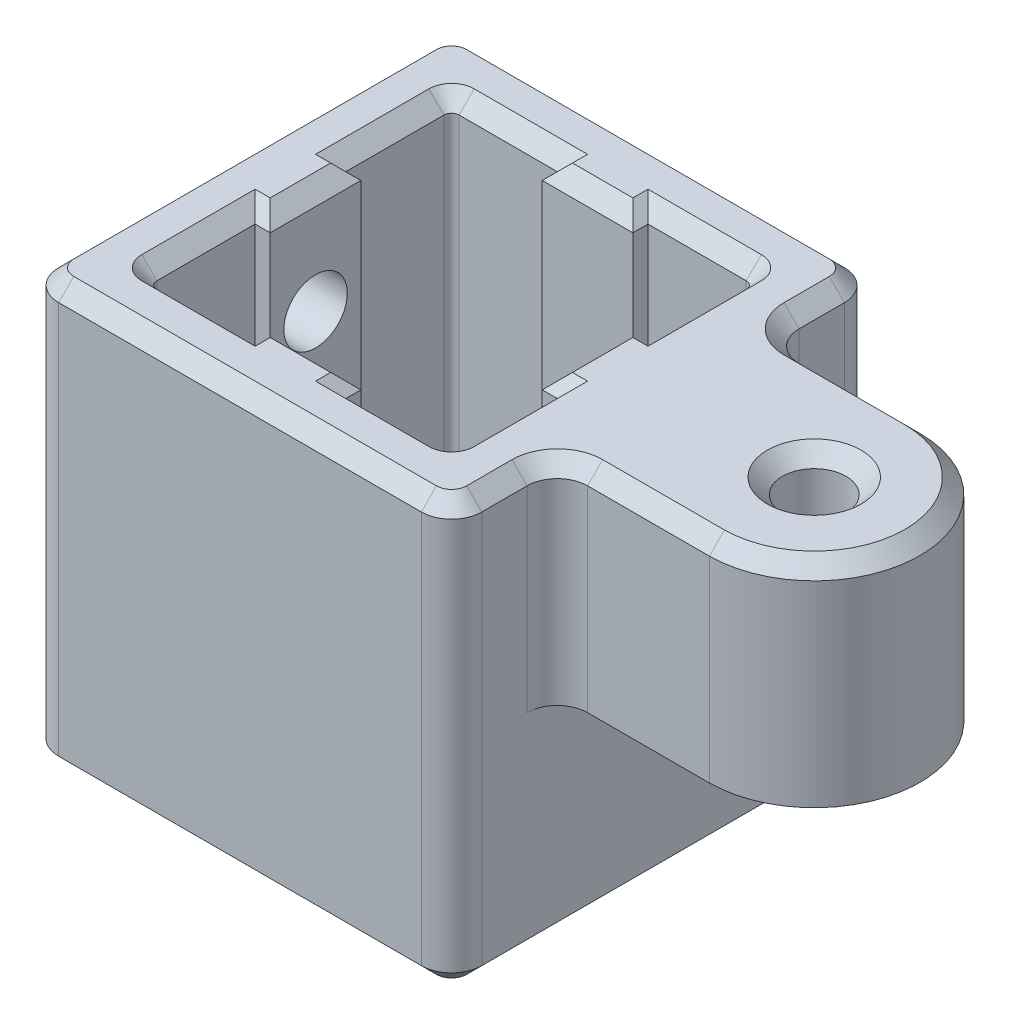
from build123d import *

# Parameters (mm, degrees)
CROQUIS1_R              = 2.1
SALIENTE_EXTRUIR1_DEPTH = 7
CROQUIS2_W              = 28
CROQUIS2_H              = 28
CROQUIS2_W_2            = 20
CROQUIS2_H_2            = 20
SALIENTE_EXTRUIR2_DEPTH = 28
CROQUIS3_W              = 6
CROQUIS3_H              = 1
CROQUIS3_W_2            = 1
CROQUIS3_H_2            = 6
SALIENTE_EXTRUIR3_DEPTH = 28
REDONDEO1_R             = 0.5
REDONDEO2_R             = 2
REDONDEO3_R             = 2
CHAFL_N1_SIZE           = 1
CHAFL_N3_SIZE           = 1
CORTAR_EXTRUIR2_REACH   = 53.595
CROQUIS4_R              = 2.1


with BuildPart() as part:
    # Croquis1 → Saliente-Extruir1 (new, symmetric)
    with BuildSketch(Plane(origin=(0, 0, 0), x_dir=(1, 0, 0), z_dir=(0, 1, 0))):
        with BuildLine():
            Line((0, 7), (-10, 7))
            Line((-10, 7), (-10, -6.999720999))
            Line((-10, -6.999720999), (0.062497509, -6.999720999))
            ThreePointArc((0.062497509, -6.999720999), (6.999930249, 0.031249066), (0, 7))
        make_face()
        with Locations(Location((0, 0, 0), (0, 0, 270))):
            Circle(CROQUIS1_R, mode=Mode.SUBTRACT)
    extrude(amount=SALIENTE_EXTRUIR1_DEPTH, both=True)

    # Croquis2 → Saliente-Extruir2 (add)
    with BuildSketch(Plane(origin=(0, 7, 0), x_dir=(1, 0, 0), z_dir=(0, 1, 0))):
        with Locations((-24, 0)):
            Rectangle(CROQUIS2_W, CROQUIS2_H)
        with Locations((-24, 0)):
            Rectangle(CROQUIS2_W_2, CROQUIS2_H_2, mode=Mode.SUBTRACT)
    extrude(amount=-SALIENTE_EXTRUIR2_DEPTH)

    # Croquis3 → Saliente-Extruir3 (add, through all)
    with BuildSketch(Plane(origin=(0, 7, 0), x_dir=(1, 0, 0), z_dir=(0, 1, 0))):
        with Locations((-24, 9.5)):
            Rectangle(CROQUIS3_W, CROQUIS3_H)
        with Locations((-14.5, 0)):
            Rectangle(CROQUIS3_W_2, CROQUIS3_H_2)
        with Locations((-24, -9.5)):
            Rectangle(CROQUIS3_W, CROQUIS3_H)
        with Locations((-33.5, 0)):
            Rectangle(CROQUIS3_W_2, CROQUIS3_H_2)
    extrude(amount=-SALIENTE_EXTRUIR3_DEPTH)

    # Redondeo1
    redondeo1_edges = [part.edges().sort_by_distance(p)[0] for p in [
        (-14, -7, 10),
        (-34, -7, 10),
        (-34, -7, -10),
        (-14, -7, -10),
    ]]
    fillet(redondeo1_edges, radius=REDONDEO1_R)

    # Redondeo2
    redondeo2_edges = [part.edges().sort_by_distance(p)[0] for p in [
        (-10, -7, -14),
        (-10, -7, 14),
        (-38, -7, 14),
        (-38, -7, -14),
    ]]
    fillet(redondeo2_edges, radius=REDONDEO2_R)

    # Redondeo3
    redondeo3_edges = [part.edges().sort_by_distance(p)[0] for p in [
        (-10, 0, 6.999720999),
        (-10, 0, -7),
    ]]
    fillet(redondeo3_edges, radius=REDONDEO3_R)

    # Chaflán1
    chafl_n1_edges = [part.edges().sort_by_distance(p)[0] for p in [
        (-30.25, -21, 10),
        (-14.146446609, -21, 9.853553391),
        (-14.146446609, -21, -9.853553391),
        (-33.853553391, -21, -9.853553391),
        (-33.853553391, -21, 9.853553391),
        (-24, -21, -14),
        (-38, -21, 0),
        (-10, -21, 0),
        (-24, -21, 14),
        (-10.585786438, -21, 13.414213562),
        (-37.414213562, -21, 13.414213562),
        (-10.585786438, -21, -13.414213562),
        (-37.414213562, -21, -13.414213562),
        (-30.25, -21, -10),
        (-21, -21, -9.5),
        (-24, -21, -9),
        (-27, -21, -9.5),
        (-14, -21, -6.25),
        (-14.5, -21, 3),
        (-15, -21, 0),
        (-14.5, -21, -3),
        (-17.75, -21, 10),
        (-27, -21, 9.5),
        (-24, -21, 9),
        (-21, -21, 9.5),
        (-34, -21, 6.25),
        (-33, -21, 0),
        (-33.5, -21, 3),
        (-33.5, -21, -3),
        (-14, -21, 6.25),
        (-17.75, -21, -10),
        (-34, -21, -6.25),
    ]]
    chamfer(chafl_n1_edges, length=CHAFL_N1_SIZE)

    # Chaflán3
    chafl_n3_edges = [part.edges().sort_by_distance(p)[0] for p in [
        (-21, 7, -9.5),
        (-24, 7, -9),
        (-27, 7, -9.5),
        (-30.25, 7, -10),
        (-33.853553391, 7, -9.853553391),
        (-34, 7, -6.25),
        (-33.5, 7, -3),
        (-33, 7, 0),
        (-33.5, 7, 3),
        (-34, 7, 6.25),
        (-33.853553391, 7, 9.853553391),
        (-30.25, 7, 10),
        (-27, 7, 9.5),
        (-24, 7, 9),
        (-21, 7, 9.5),
        (-17.75, 7, 10),
        (-14.146446609, 7, 9.853553391),
        (-14, 7, 6.25),
        (-14.5, 7, 3),
        (-15, 7, 0),
        (-14.5, 7, -3),
        (-14, 7, -6.25),
        (-14.146446609, 7, -9.853553391),
        (-17.75, 7, -10),
        (0, 7, -2.1),
        (-10.585786438, 7, -13.414213562),
        (-10, 7, -10.5),
        (-9.414213562, 7, -7.585786438),
        (-4, 7, -7),
        (6.999930249, 7, -0.031249066),
        (-3.968751246, 7, 6.999720999),
        (-9.414213562, 7, 7.585507436),
        (-10, 7, 10.499860499),
        (-10.585786438, 7, 13.414213562),
        (-24, 7, 14),
        (-37.414213562, 7, 13.414213562),
        (-38, 7, 0),
        (-37.414213562, 7, -13.414213562),
        (-24, 7, -14),
    ]]
    chamfer(chafl_n3_edges, length=CHAFL_N3_SIZE)

    # Croquis4 → Cortar-Extruir2 (cut, up to next)
    with BuildSketch(Plane.ZY.offset(38), mode=Mode.PRIVATE) as cortar_extruir2_sk1:
        Circle(CROQUIS4_R)
    cortar_extruir2_tool1 = extrude(cortar_extruir2_sk1.sketch, amount=-CORTAR_EXTRUIR2_REACH, mode=Mode.PRIVATE) & part.part
    # Croquis4 → Cortar-Extruir2 (cut, up to next)
    with BuildSketch(Plane.ZY.offset(38), mode=Mode.PRIVATE) as cortar_extruir2_sk2:
        with Locations((0, -14)):
            Circle(CROQUIS4_R)
    cortar_extruir2_tool2 = extrude(cortar_extruir2_sk2.sketch, amount=-CORTAR_EXTRUIR2_REACH, mode=Mode.PRIVATE) & part.part
    add(cortar_extruir2_tool1.solids().sort_by_distance((-38, 0, 0))[0], mode=Mode.SUBTRACT)
    add(cortar_extruir2_tool2.solids().sort_by_distance((-38, -14, 0))[0], mode=Mode.SUBTRACT)


solid = part.part
